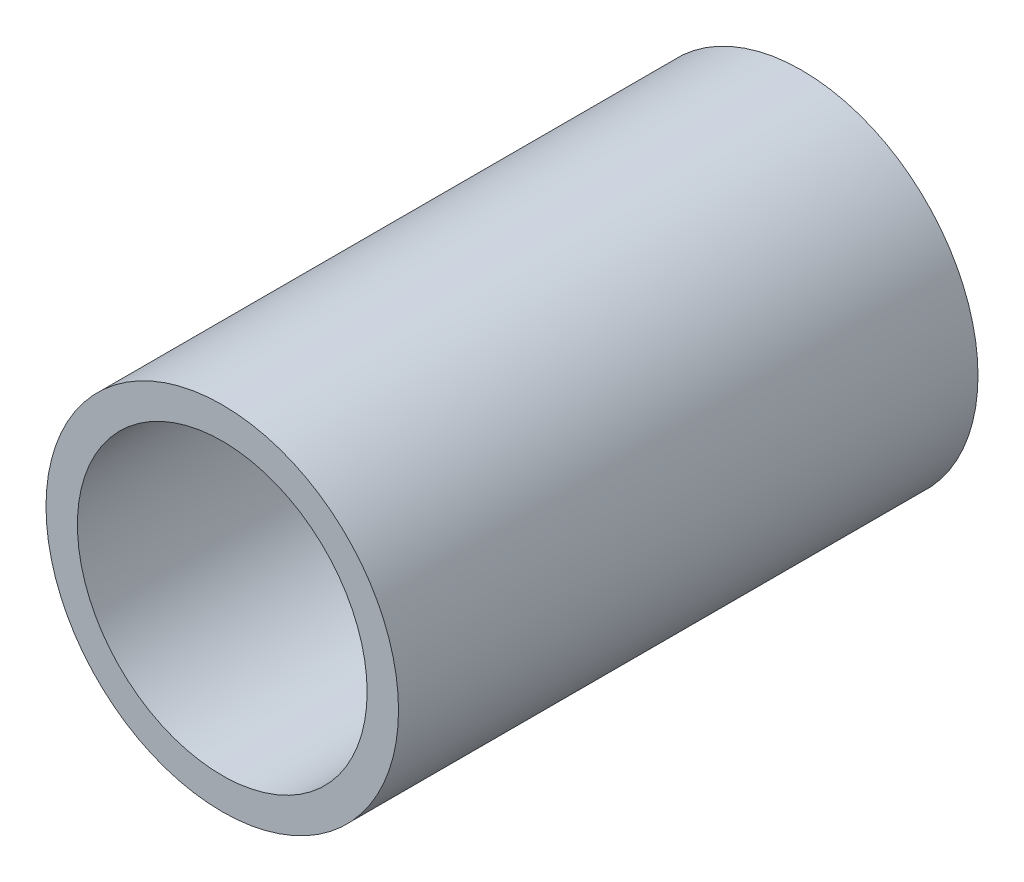
from build123d import *

# Parameters (mm, degrees)
SKETCH_1_R      = 3.65
SKETCH_1_R_2    = 3
EXTRUDE_1_DEPTH = 12


with BuildPart() as part:
    # Эскиз1 → Бобышка-Вытянуть1 (new body)
    with BuildSketch(Plane.XY):
        Circle(SKETCH_1_R)
        Circle(SKETCH_1_R_2, mode=Mode.SUBTRACT)
    extrude(amount=EXTRUDE_1_DEPTH)


solid = part.part
